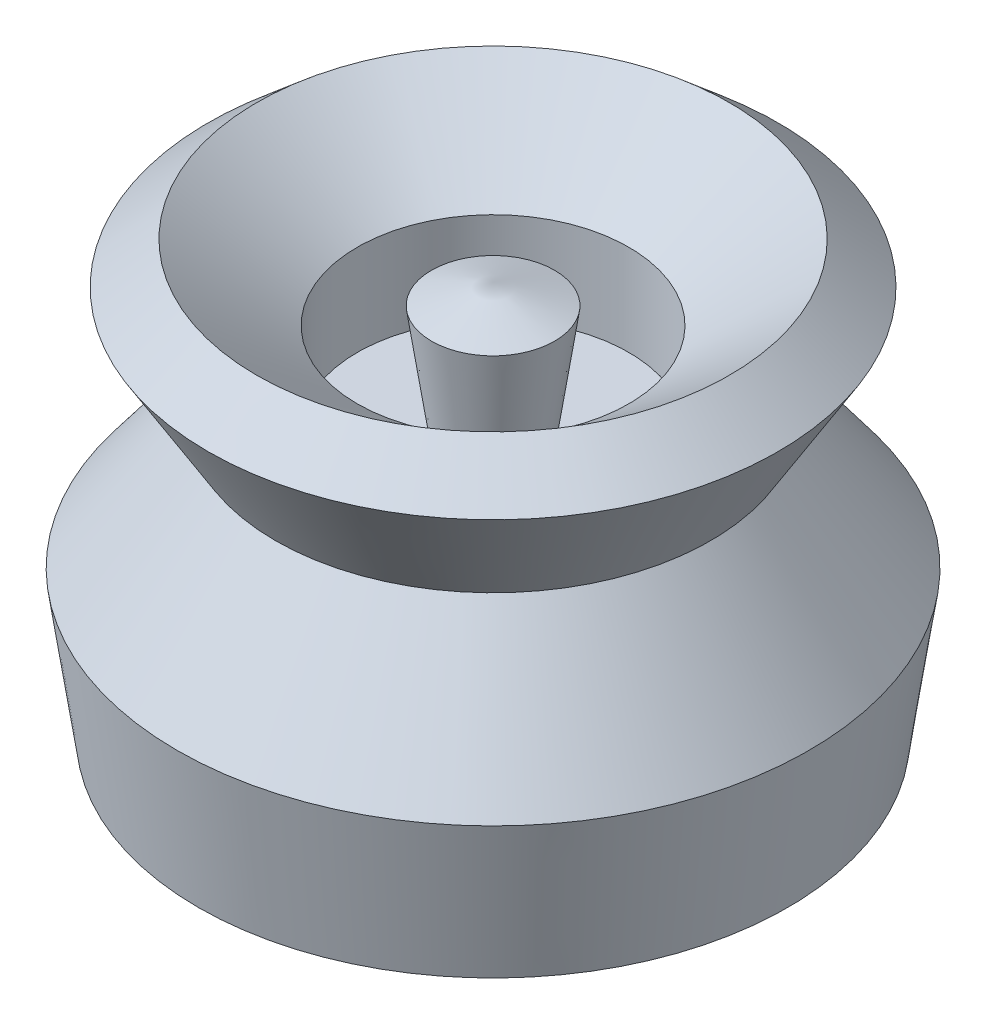
from build123d import *


with BuildPart() as part:
    # Sketch1 → Revolve1 (revolve)
    with BuildSketch(Plane.XY, mode=Mode.PRIVATE) as revolve1_sk:
        Polygon((0, 37.498384966), (0, -30.927670984), (68.652632294, -30.927670984), (73.637311867, 3.285356991), (50.667608306, 34.089688123), (66.386868852, 59.929443042), (55.058051642, 69.672225843), (31.627805024, 52.201117093), (31.627805024, 48.827202176), (31.627805024, 30.969839997), (10.649088178, 30.969839997), (14.324766252, 56.198357692), (0, 60.936671468), align=None)
    revolve(revolve1_sk.sketch.rotate(Axis((0, 37.498384966, 0), (0, -1, 0)), 90), axis=Axis((0, 37.498384966, 0), (0, -1, 0)))


solid = part.part
